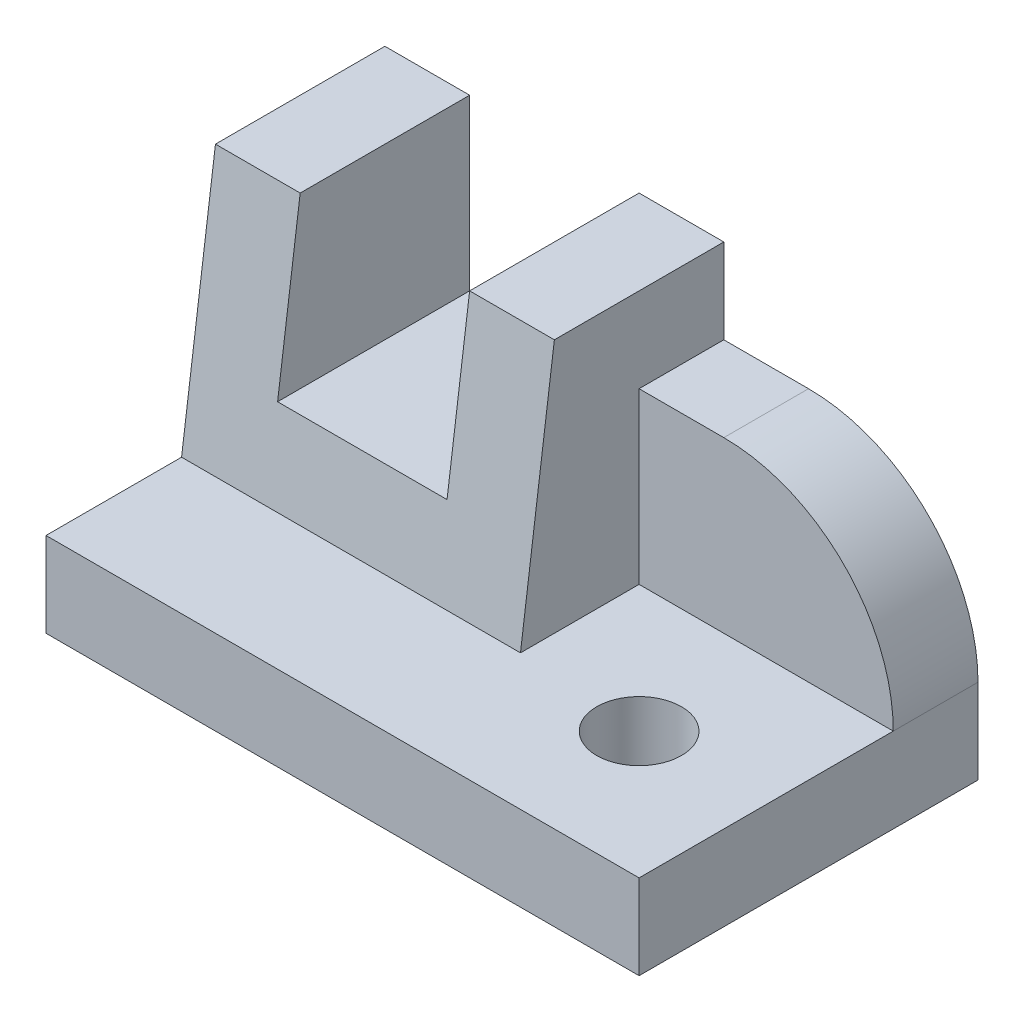
from build123d import *

# Parameters (mm, degrees)
BOSS_EXTRUDE1_DEPTH            = 40
SKETCH2_W                      = 40
SKETCH2_H                      = 30
BOSS_EXTRUDE2_DEPTH            = 20
BOSS_EXTRUDE3_DEPTH            = 30
CUT_EXTRUDE1_DEPTH             = 30
SKETCH5_W                      = 70
SKETCH5_H                      = 40
BOSS_EXTRUDE4_DEPTH            = 10
SKETCH6_W                      = 20
SKETCH6_H                      = 20
CUT_EXTRUDE2_DEPTH             = 91
F_10_0_10_DIAMETER_HOLE1_D     = 10
F_10_0_10_DIAMETER_HOLE1_DEPTH = 40
FILLET1_R                      = 20


with BuildPart() as part:
    # Sketch1 → Boss-Extrude1 (new body)
    with BuildSketch(Plane(origin=(0, 0, 0), x_dir=(0, -1, 0), z_dir=(-1, 0, 0))):
        Polygon((-10, -16), (-40, -20), (-10, -20), align=None)
    extrude(amount=-BOSS_EXTRUDE1_DEPTH)

    # Sketch2 → Boss-Extrude2 (add)
    with BuildSketch(Plane(origin=(0, 0, -20), x_dir=(-1, 0, 0), z_dir=(0, 0, -1))):
        with Locations((-20, 25)):
            Rectangle(SKETCH2_W, SKETCH2_H)
    extrude(amount=BOSS_EXTRUDE2_DEPTH)

    # Sketch3 → Boss-Extrude3 (add)
    with BuildSketch(Plane(origin=(40, 0, 0), x_dir=(0, 0, -1), z_dir=(1, 0, 0))):
        Polygon((40, 10), (0, 10), (20, 40), (40, 40), align=None)
    extrude(amount=BOSS_EXTRUDE3_DEPTH)

    # Sketch4 → Cut-Extrude1 (cut)
    with BuildSketch(Plane(origin=(70, 0, 0), x_dir=(0, 0, -1), z_dir=(1, 0, 0))):
        Polygon((20, 40), (0, 10), (30, 10), (30, 30), (40, 30), (40, 40), align=None)
    extrude(amount=-CUT_EXTRUDE1_DEPTH, mode=Mode.SUBTRACT)

    # Sketch5 → Boss-Extrude4 (add)
    with BuildSketch(Plane.XZ.offset(-10)):
        with Locations((35, -20)):
            Rectangle(SKETCH5_W, SKETCH5_H)
    extrude(amount=BOSS_EXTRUDE4_DEPTH)

    # Sketch6 → Cut-Extrude2 (cut, through all)
    with BuildSketch(Plane(origin=(0, 0, -40), x_dir=(-1, 0, 0), z_dir=(0, 0, -1))):
        with Locations((-20, 30)):
            Rectangle(SKETCH6_W, SKETCH6_H)
    extrude(amount=-CUT_EXTRUDE2_DEPTH, mode=Mode.SUBTRACT)

    # Ø10.0 (10) Diameter Hole1
    with Locations(Plane(origin=(0, 0, 0), x_dir=(-1, 0, 0), z_dir=(0, -1, 0))):
        with Locations((-55, 15)):
            Hole(F_10_0_10_DIAMETER_HOLE1_D / 2, depth=F_10_0_10_DIAMETER_HOLE1_DEPTH)

    # Fillet1
    fillet1_edges = [part.edges().sort_by_distance(p)[0] for p in [
        (70, 30, -35),
    ]]
    fillet(fillet1_edges, radius=FILLET1_R)


solid = part.part
